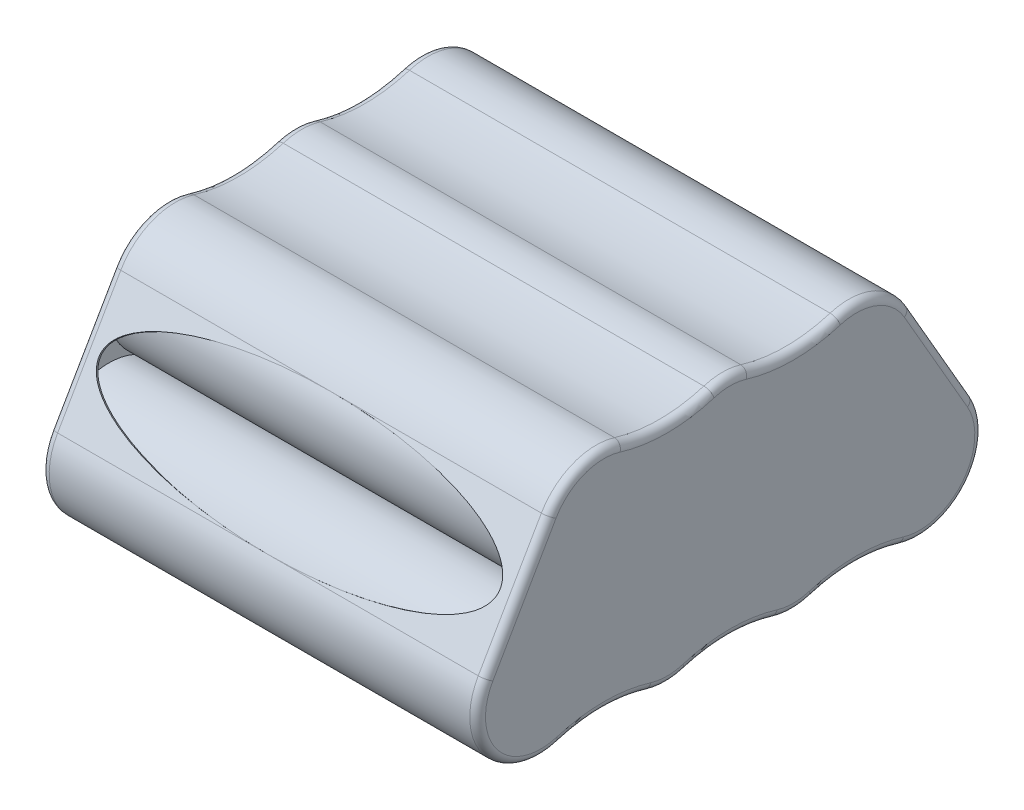
from build123d import *

# Parameters (mm, degrees)
BOSS_EXTRUDE2_DEPTH = 25
BOSS_EXTRUDE4_DEPTH = 0.5
BOSS_EXTRUDE5_START = -0.5
BOSS_EXTRUDE5_DEPTH = 0.5
BOSS_EXTRUDE3_DEPTH = 0.2
FILLET2_R           = 0.9
FILLET3_R           = 0.5


with BuildPart() as part:
    # Sketch1 → Boss-Extrude2 (new, symmetric)
    with BuildSketch(Plane(origin=(0, 0, 0), x_dir=(0, 0, -1), z_dir=(1, 0, 0))):
        with BuildLine():
            ThreePointArc((18.086570703, 0.969256515), (21.103666755, 10.119839498), (12.353200868, 14.152876106))
            ThreePointArc((12.353200868, 14.152876106), (7.234628155, 13.387576994), (2.116055446, 14.15287613))
            ThreePointArc((2.116055446, 14.15287613), (5e-08, 14.469256391), (-2.116055351, 14.152876159))
            ThreePointArc((-2.116055351, 14.152876159), (-7.234628215, 13.387576994), (-12.353201078, 14.15287617))
            ThreePointArc((-12.353201078, 14.15287617), (-21.103666805, 10.119839382), (-18.086570675, 0.969256499))
            ThreePointArc((-18.086570675, 0.969256499), (-28.892058133, -4.477576347), (-19.587829355, -12.214363413))
            ThreePointArc((-19.587829355, -12.214363413), (-14.469256551, -11.449064211), (-9.350683733, -12.214363319))
            ThreePointArc((-9.350683733, -12.214363319), (-7.234628203, -12.530743609), (-5.118572672, -12.214363324))
            ThreePointArc((-5.118572672, -12.214363324), (3.1e-08, -11.449064211), (5.118572731, -12.214363342))
            ThreePointArc((5.118572731, -12.214363342), (7.23462823, -12.530743609), (9.350683726, -12.214363321))
            ThreePointArc((9.350683726, -12.214363321), (14.469256557, -11.449064211), (19.587829373, -12.214363418))
            ThreePointArc((19.587829373, -12.214363418), (28.892058134, -4.477576354), (18.086570703, 0.969256515))
        make_face()
    extrude(amount=BOSS_EXTRUDE2_DEPTH, both=True)

    # Sketch3 → Boss-Extrude4 (add)
    with BuildSketch(Plane(origin=(25, 0, 0), x_dir=(0, 0, -1), z_dir=(1, 0, 0))):
        with BuildLine():
            ThreePointArc((-18.086570675, 0.969256499), (-21.457370637, 5.362168738), (-20.734628196, 10.851942293))
            Line((-20.734628196, 10.851942293), (-27.969256391, -1.678801315))
            ThreePointArc((-27.969256391, -1.678801315), (-23.576344252, 1.691998777), (-18.086570675, 0.969256499))
        make_face()
    boss_extrude4 = extrude(amount=-BOSS_EXTRUDE4_DEPTH)

    # Sketch4 → Boss-Extrude5 (add)
    with BuildSketch(Plane.ZY.offset(25).offset(BOSS_EXTRUDE5_START)):
        with BuildLine():
            Line((27.969256391, -1.678801315), (20.734628196, 10.851942293))
            ThreePointArc((20.734628196, 10.851942293), (21.457370609, 5.362168634), (18.086570489, 0.969256391))
            ThreePointArc((18.086570489, 0.969256391), (23.576344148, 1.691998805), (27.969256391, -1.678801315))
        make_face()
    boss_extrude5 = extrude(amount=BOSS_EXTRUDE5_DEPTH)

    # Sketch2 → Boss-Extrude3 (add)
    with BuildSketch(Plane(origin=(0, 11.691342951, 20.25), x_dir=(1, 0, 0), z_dir=(0, 0.5000000000000007, 0.8660254037844384))):
        with BuildLine():
            Line((1.78e-07, -0.969256391), (-25, -0.969256391))
            Line((-25, -0.969256391), (-25, -15.438512783))
            Line((-25, -15.438512783), (-2e-09, -15.438512783))
            add(Edge.make_bspline(
                [(-23, -8.203884587), (-23, -15.438512782), (-2e-09, -15.438512783)],
                knots=[0, 0, 0, 1.570796327, 1.570796327, 1.570796327], degree=2, weights=[1, 0.707106781, 1]))
            add(Edge.make_bspline(
                [(1.78e-07, -0.969256391), (-23, -0.969256335), (-23, -8.203884587)],
                knots=[4.712388973, 4.712388973, 4.712388973, 6.283185307, 6.283185307, 6.283185307], degree=2, weights=[1, 0.707106778, 1]))
        make_face()
        with BuildLine():
            Line((25, -0.969256391), (1.78e-07, -0.969256391))
            add(Edge.make_bspline(
                [(-2e-09, -15.438512783), (22.99999991, -15.438512783), (23, -8.203884615), (23.00000009, -0.969256447), (1.78e-07, -0.969256391)],
                knots=[1.570796327, 1.570796327, 1.570796327, 3.14159265, 3.14159265, 4.712388973, 4.712388973, 4.712388973], degree=2, weights=[1, 0.707106783, 1, 0.707106783, 1]))
            Line((-2e-09, -15.438512783), (25, -15.438512783))
            Line((25, -15.438512783), (25, -0.969256391))
        make_face()
    boss_extrude3 = extrude(amount=-BOSS_EXTRUDE3_DEPTH)

    # Mirror1: Boss-Extrude4, Boss-Extrude5, Boss-Extrude3 across plane
    add(boss_extrude4.mirror(Plane.XY))
    add(boss_extrude5.mirror(Plane.XY))
    add(boss_extrude3.mirror(Plane.XY))

    # Fillet2
    fillet2_edges = [part.edges().sort_by_distance(p)[0] for p in [
        (25, 13.966017185, -17.120340586),
        (25, 4.586570489, -24.351942293),
        (-25, 13.966017185, -17.120340586),
        (-25, 4.586570489, -24.351942293),
        (-25, 13.387576994, 7.234628215),
        (-25, 14.469256391, -5e-08),
        (-25, 13.387576994, -7.234628155),
        (25, -11.449064211, 14.469256551),
        (-25, -9.800127056, -27.365485442),
        (-25, -11.449064211, -14.469256557),
        (-25, -12.530743609, -7.23462823),
        (-25, -11.449064211, -3.1e-08),
        (-25, -12.530743609, 7.234628203),
        (-25, -11.449064211, 14.469256551),
        (-25, 13.966017144, 17.120340688),
        (25, -12.530743609, 7.234628203),
        (25, -11.449064211, -3.1e-08),
        (25, -12.530743609, -7.23462823),
        (25, -11.449064211, -14.469256557),
        (25, -9.800127056, -27.365485442),
        (25, -9.800127063, 27.365485437),
        (25, 4.586570489, 24.351942293),
        (25, 13.966017144, 17.120340688),
        (25, 13.387576994, -7.234628155),
        (25, 14.469256391, -5e-08),
        (-25, -9.800127063, 27.365485437),
        (-25, 4.586570489, 24.351942293),
        (25, 13.387576994, 7.234628215),
    ]]
    fillet(fillet2_edges, radius=FILLET2_R)

    # Fillet3
    fillet3_edges = [part.edges().sort_by_distance(p)[0] for p in [
        (24.5, 4.486570489, -24.178737213),
        (-24.5, 4.486570489, -24.178737213),
        (24.5, 4.486570489, 24.178737213),
        (-24.5, 4.486570489, 24.178737213),
    ]]
    fillet(fillet3_edges, radius=FILLET3_R)


solid = part.part
